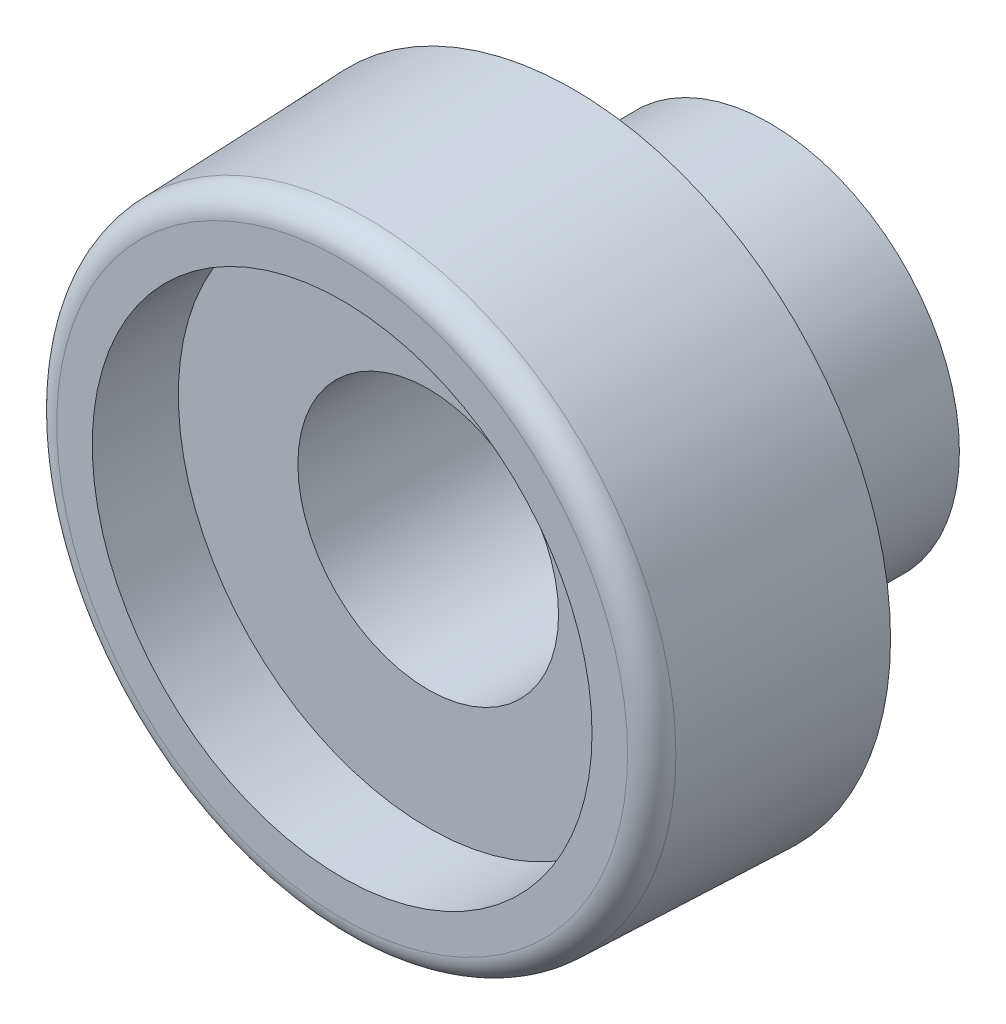
from build123d import *

# Parameters (mm, degrees)
ESQUISSE1_R             = 6.45
ESQUISSE1_R_2           = 5.15
BOSS_EXTRU_1_DEPTH      = 4.7
BOSS_EXTRU_1_DRAFT      = 2
ESQUISSE2_R             = 6.285872383
ESQUISSE2_R_2           = 2.65
BOSS_EXTRU_2_DEPTH      = 4.7
CONG_1_R                = 0.5
ESQUISSE4_R             = 5.080745256
ENL_V_MAT_EXTRU_1_DEPTH = 1.75
ESQUISSE3_R             = 3.85
ESQUISSE3_R_2           = 2.65
BOSS_EXTRU_8_DEPTH      = 4


with BuildPart() as part:
    # Esquisse1 → Boss.-Extru.1 (with draft: the straight prism first)
    with BuildSketch(Plane.XY):
        Circle(ESQUISSE1_R)
        Circle(ESQUISSE1_R_2, mode=Mode.SUBTRACT)
    extrude(amount=BOSS_EXTRU_1_DEPTH)
    # Boss.-Extru.1: the draft: its side faces are tilted about the plane it starts from
    boss_extru_1_sides = [part.faces().sort_by_distance(p)[0] for p in [
        (-6.45, 0, 2.35),
        (-5.15, 0, 2.35),
    ]]
    draft(boss_extru_1_sides, Plane.XY, BOSS_EXTRU_1_DRAFT)

    # Esquisse2 → Boss.-Extru.2 (add)
    with BuildSketch(Plane.XY.offset(4.7)):
        Circle(ESQUISSE2_R)
        Circle(ESQUISSE2_R_2, mode=Mode.SUBTRACT)
    extrude(amount=-BOSS_EXTRU_2_DEPTH)

    # Congé1
    cong_1_edges = [part.edges().sort_by_distance(p)[0] for p in [
        (-6.285872383, 0, 4.7),
    ]]
    fillet(cong_1_edges, radius=CONG_1_R)

    # Esquisse4 → Enlèv. mat.-Extru.1 (cut)
    with BuildSketch(Plane.XY.offset(4.7)):
        Circle(ESQUISSE4_R)
    extrude(amount=-ENL_V_MAT_EXTRU_1_DEPTH, mode=Mode.SUBTRACT)

    # Esquisse3 → Boss.-Extru.8 (add)
    with BuildSketch(Plane(origin=(0, 0, 0), x_dir=(-1, 0, 0), z_dir=(0, 0, -1))):
        with Locations(Location((0, 0, 0), (0, 0, 180))):
            Circle(ESQUISSE3_R)
        with Locations(Location((0, 0, 0), (0, 0, 180))):
            Circle(ESQUISSE3_R_2, mode=Mode.SUBTRACT)
    extrude(amount=BOSS_EXTRU_8_DEPTH)


solid = part.part
